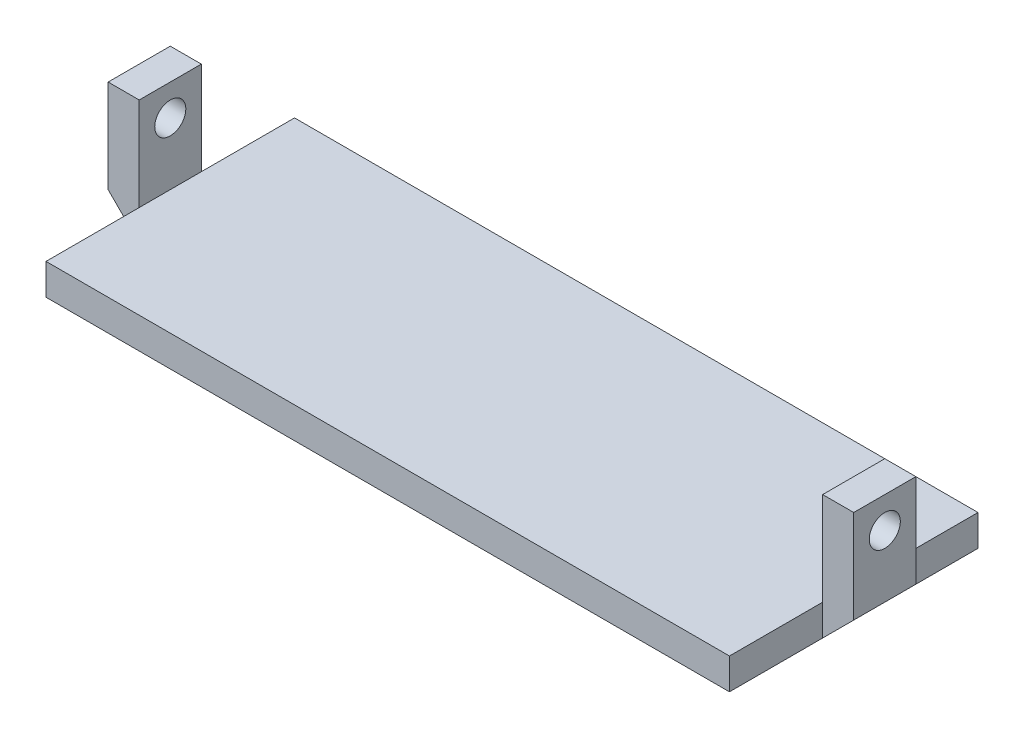
from build123d import *

# Parameters (mm, degrees)
SKETCH1_W           = 120
SKETCH1_H           = 85
BOSS_EXTRUDE1_DEPTH = 5
SKETCH2_W           = 5
SKETCH2_H           = 10
BOSS_EXTRUDE2_DEPTH = 15
SKETCH3_R           = 2.5
CUT_EXTRUDE1_DEPTH  = 129.865239689
SKETCH5_W           = 5
SKETCH5_H           = 25
SKETCH5_H_2         = 15
CUT_EXTRUDE2_DEPTH  = 76.041655099
CHAMFER1_SIZE       = 5
SKETCH6_W           = 110
SKETCH6_H           = 10
CUT_EXTRUDE3_DEPTH  = 77.198753271


with BuildPart() as part:
    # Sketch1 → Boss-Extrude1 (new body)
    with BuildSketch(Plane(origin=(0, 0, 0), x_dir=(1, 0, 0), z_dir=(0, 1, 0))):
        Rectangle(SKETCH1_W, SKETCH1_H)
    extrude(amount=BOSS_EXTRUDE1_DEPTH)

    # Sketch2 → Boss-Extrude2 (add)
    with BuildSketch(Plane(origin=(0, 5, 0), x_dir=(1, 0, 0), z_dir=(0, 1, 0))):
        with Locations((-57.5, 12.5)):
            Rectangle(SKETCH2_W, SKETCH2_H)
        with Locations((-57.5, -12.5)):
            Rectangle(SKETCH2_W, SKETCH2_H)
        with Locations((57.5, -12.5)):
            Rectangle(SKETCH2_W, SKETCH2_H)
        with Locations((57.5, 12.5)):
            Rectangle(SKETCH2_W, SKETCH2_H)
    extrude(amount=BOSS_EXTRUDE2_DEPTH)

    # Sketch3 → Cut-Extrude1 (cut, through all)
    with BuildSketch(Plane.ZY.offset(60)):
        with Locations((-12.5, 15)):
            Circle(SKETCH3_R)
        with Locations((12.5, 15)):
            Circle(SKETCH3_R)
    extrude(amount=-CUT_EXTRUDE1_DEPTH, mode=Mode.SUBTRACT)

    # Sketch5 → Cut-Extrude2 (cut, through all)
    with BuildSketch(Plane(origin=(0, 5, 0), x_dir=(1, 0, 0), z_dir=(0, 1, 0))):
        with Locations((-57.5, 30)):
            Rectangle(SKETCH5_W, SKETCH5_H)
        with Locations((-57.5, 0)):
            Rectangle(SKETCH5_W, SKETCH5_H_2)
        with Locations((-57.5, -30)):
            Rectangle(SKETCH5_W, SKETCH5_H)
        with Locations((57.5, -30)):
            Rectangle(SKETCH5_W, SKETCH5_H)
        with Locations((57.5, 0)):
            Rectangle(SKETCH5_W, SKETCH5_H_2)
        with Locations((57.5, 30)):
            Rectangle(SKETCH5_W, SKETCH5_H)
    extrude(amount=-CUT_EXTRUDE2_DEPTH, mode=Mode.SUBTRACT)

    # Chamfer1
    chamfer1_edges = [part.edges().sort_by_distance(p)[0] for p in [
        (-60, 0, 12.5),
        (-60, 0, -12.5),
        (60, 0, -12.5),
        (60, 0, 12.5),
    ]]
    chamfer(chamfer1_edges, length=CHAMFER1_SIZE)

    # Sketch6 → Cut-Extrude3 (cut, through all)
    with BuildSketch(Plane.XZ):
        Polygon((-55, -7.5), (55, -7.5), (55, -17.5), (55, -42.5), (-55, -42.5), (-55, -17.5), align=None)
        Polygon((-60, -7.5), (-60, -42.5), (-55, -42.5), (-55, -17.5), (-55, -7.5), align=None)
        with Locations((0, 37.5)):
            Rectangle(SKETCH6_W, SKETCH6_H)
        Polygon((55, -42.5), (60, -42.5), (60, -7.5), (55, -7.5), (55, -17.5), align=None)
    extrude(amount=-CUT_EXTRUDE3_DEPTH, mode=Mode.SUBTRACT)


solid = part.part
